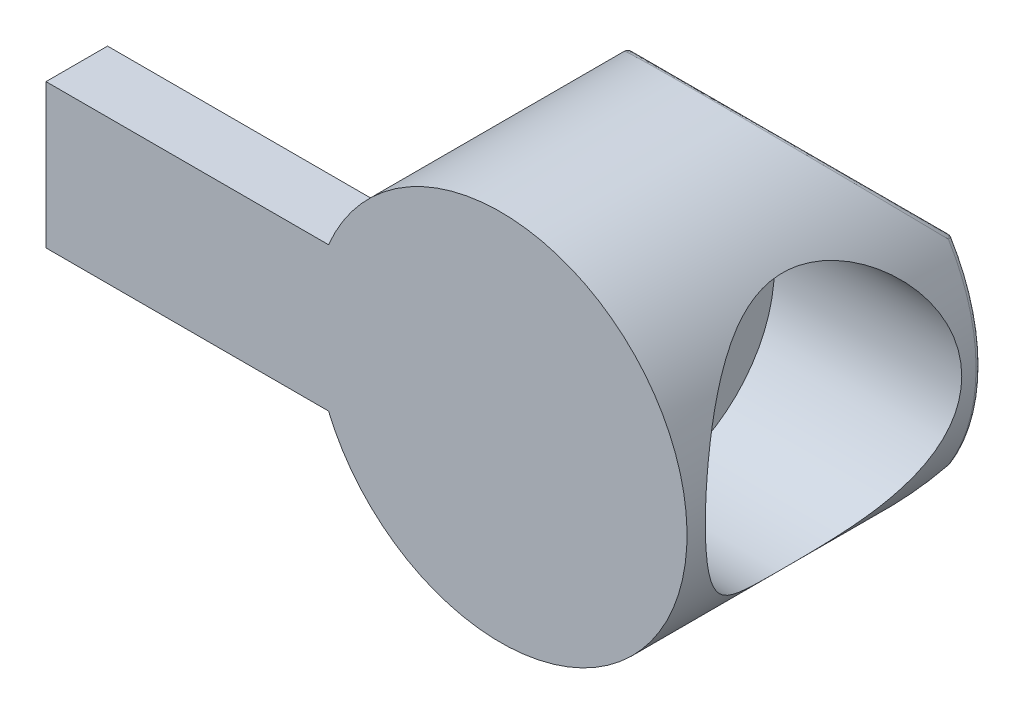
from build123d import *

# Parameters (mm, degrees)
SKETCH1_R                = 10.16
PART_DIA_EXTRUDE_DEPTH   = 16.002
SKETCH1_3_W              = 24.765
SKETCH1_3_H              = 7.8486
ARM_EXTRUDE_DEPTH        = 3.3528
SKETCH2_R                = 6.985
CBORE_EXTRUDE_DEPTH      = 10.2108
SKETCH2_3_R              = 4.1656
THRU_HOLE_EXTRUDE2_DEPTH = 40.737202144
ANGLE_EXTRUDE3_DEPTH     = 40.737202144
FILLET1_R                = 0.254


with BuildPart() as part:
    # Sketch1 → PART DIA EXTRUDE (new body)
    with BuildSketch(Plane.XY):
        Circle(SKETCH1_R)
    extrude(amount=-PART_DIA_EXTRUDE_DEPTH)

    # Sketch1<3> → ARM EXTRUDE (add)
    with BuildSketch(Plane.XY):
        with Locations((-12.3825, 0)):
            Rectangle(SKETCH1_3_W, SKETCH1_3_H)
    extrude(amount=-ARM_EXTRUDE_DEPTH)

    # Sketch2 → CBORE EXTRUDE (cut)
    with BuildSketch(Plane(origin=(10.16, 0, 0), x_dir=(0, 0, -1), z_dir=(1, 0, 0))):
        with Locations((7.983336866, 0)):
            Circle(SKETCH2_R)
    extrude(amount=-CBORE_EXTRUDE_DEPTH, mode=Mode.SUBTRACT)

    # Sketch2<3> → THRU HOLE-Extrude2 (cut, through all)
    with BuildSketch(Plane(origin=(10.16, 0, 0), x_dir=(0, 0, -1), z_dir=(1, 0, 0))):
        with Locations((7.983336866, 0)):
            Circle(SKETCH2_3_R)
    extrude(amount=-THRU_HOLE_EXTRUDE2_DEPTH, mode=Mode.SUBTRACT)

    # Sketch2<4> → ANGLE-Extrude3 (cut, through all)
    with BuildSketch(Plane(origin=(10.16, 0, 0), x_dir=(0, 0, -1), z_dir=(1, 0, 0))):
        Polygon((11.136104206, 10.16), (16.002, 10.16), (16.002, 5.294104206), align=None)
        Polygon((16.002, -10.16), (16.002, -5.294104206), (11.136104206, -10.16), align=None)
    extrude(amount=-ANGLE_EXTRUDE3_DEPTH, mode=Mode.SUBTRACT)

    # Fillet1
    fillet1_edges = [part.edges().sort_by_distance(p)[0] for p in [
        (-10.16, 0, -16.002),
        (-5.323615412, -8.653595723, -12.642508482),
        (0, -5.294104206, -16.002),
        (0, 5.294104206, -16.002),
        (-5.323615412, 8.653595723, -12.642508482),
        (9.780845679, -2.749665034, -16.002),
    ]]
    fillet(fillet1_edges, radius=FILLET1_R)


solid = part.part
